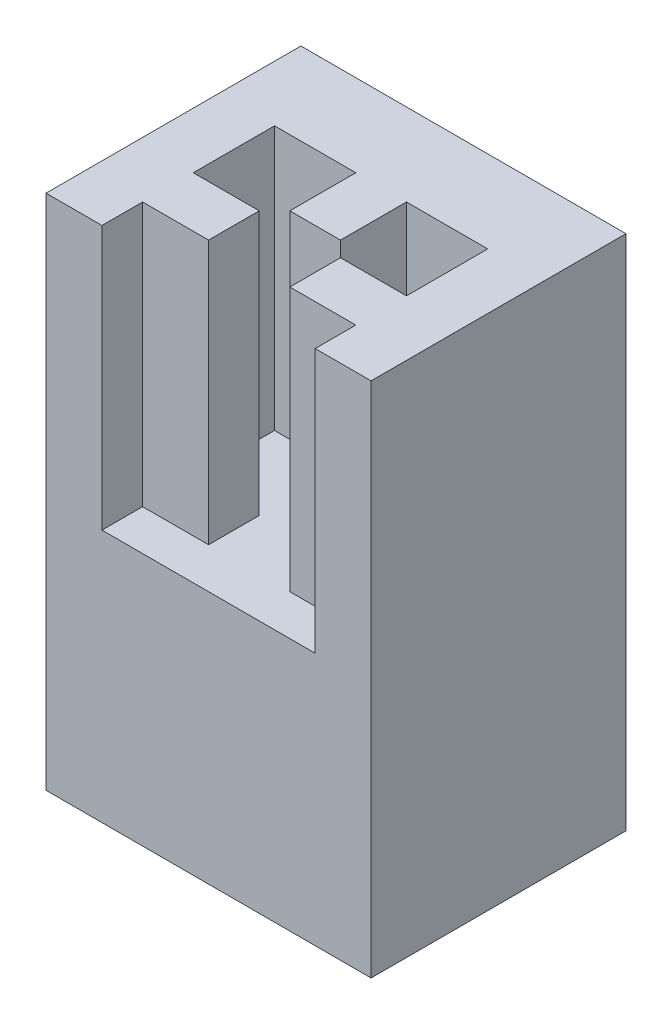
from build123d import *

# Parameters (mm, degrees)
ESQUISSE1_W                  = 30.8
ESQUISSE1_H                  = 24.15
BOSS_EXTRU_1_DEPTH           = 49
ESQUISSE3_R                  = 7.5
ENL_V_MAT_EXTRU_3_DEPTH      = 18
ENL_V_MAT_EXTRU_4_DEPTH      = 67.174451426
ENL_V_MAT_EXTRU_4_DEPTH_BACK = 25


with BuildPart() as part:
    # Esquisse1 → Boss.-Extru.1 (new body)
    with BuildSketch(Plane(origin=(0, 0, 0), x_dir=(1, 0, 0), z_dir=(0, 1, 0))):
        with Locations((-24.160479042, -8.248053892)):
            Rectangle(ESQUISSE1_W, ESQUISSE1_H)
    extrude(amount=BOSS_EXTRU_1_DEPTH)

    # Esquisse3 → Enlèv. mat.-Extru.3 (cut)
    with BuildSketch(Plane(origin=(0, 0, 0), x_dir=(-1, 0, 0), z_dir=(0, -1, 0))):
        with Locations(Location((24.160479042, -8.323053892, 0), (0, 0, 90))):
            Circle(ESQUISSE3_R)
    extrude(amount=-ENL_V_MAT_EXTRU_3_DEPTH, mode=Mode.SUBTRACT)

    # Esquisse4 → Enlèv. mat.-Extru.4 (cut, two sides: drawn at the far end of the back side and taken through both)
    with BuildSketch(Plane(origin=(0, 49, 0), x_dir=(1, 0, 0), z_dir=(0, 1, 0)).offset(-ENL_V_MAT_EXTRU_4_DEPTH_BACK)):
        Polygon((-34.260479042, -100.564708201), (-34.260479042, -20.323053892), (-34.260479042, -16.473053892), (-28.010479042, -16.473053892), (-28.010479042, -11.673053892), (-34.260479042, -11.673053892), (-34.260479042, -3.973053892), (-26.560479042, -3.973053892), (-26.560479042, -10.223053892), (-21.760479042, -10.223053892), (-21.760479042, -3.973053892), (-14.060479042, -3.973053892), (-14.060479042, -11.673053892), (-20.310479042, -11.673053892), (-20.310479042, -16.473053892), (-14.060479042, -16.473053892), (-14.060479042, -20.323053892), (-14.060479042, -100.564708201), (-14.060479042, -261.048016818), (-34.260479042, -261.048016818), align=None)
    extrude(amount=ENL_V_MAT_EXTRU_4_DEPTH + ENL_V_MAT_EXTRU_4_DEPTH_BACK, mode=Mode.SUBTRACT)


solid = part.part
